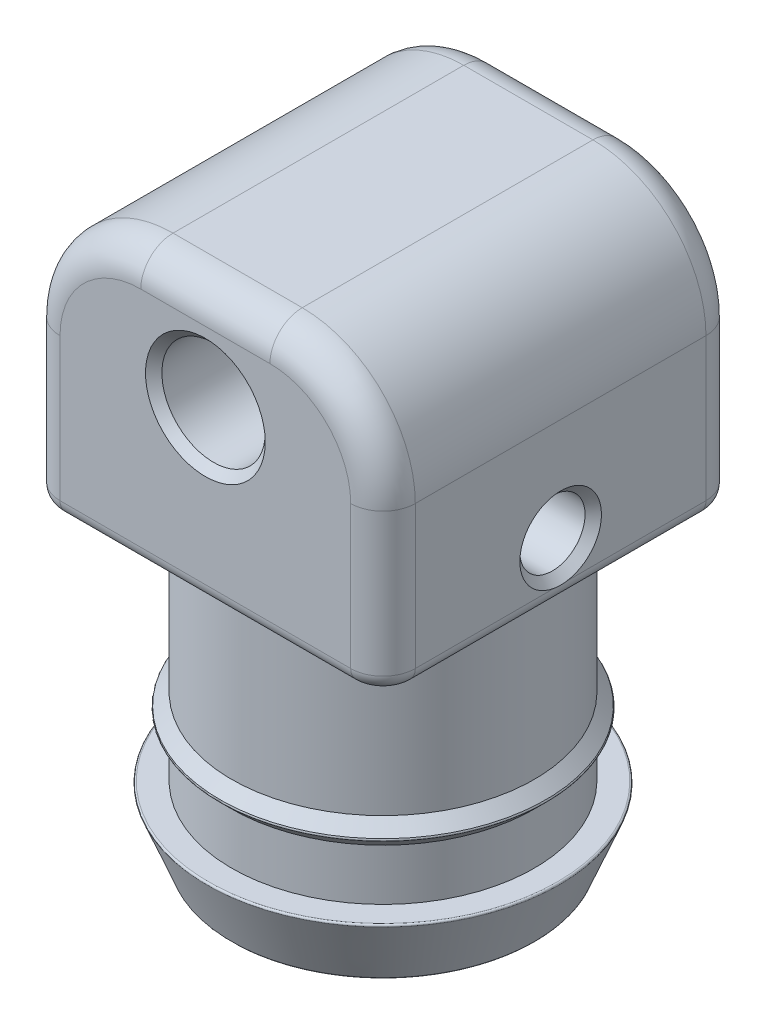
from build123d import *

# Parameters (mm, degrees)
SKETCH1_R                   = 3.2
BOSS_EXTRUDE1_DEPTH         = 11
SKETCH3_R                   = 2.38125
CUT_EXTRUDE1_DEPTH          = 25
F_10_32_TAPPED_HOLE1_REACH  = 40.409
F_10_32_TAPPED_HOLE1_BORE_R = 2.0193
FILLET3_R                   = 0.09921875
CHAMFER1_SIZE               = 0.508
FILLET4_R                   = 7
FILLET5_R                   = 2
FILLET6_R                   = 1


with BuildPart() as part:
    # Sketch1 → Boss-Extrude1 (new, symmetric)
    # profile 1 of 3: a face of its own
    with BuildSketch(Plane.XY):
        with BuildLine():
            Line((-11, 6.35), (-11, 0))
            Line((-11, 0), (-6.35, 0))
            ThreePointArc((-6.35, 0), (-4.49012806, 4.490128061), (2e-09, 6.35))
            Line((2e-09, 6.35), (-11, 6.35))
        make_face()
    # profile 2 of 3: a face of its own
    with BuildSketch(Plane.XY):
        with BuildLine():
            Line((-6.35, 0), (-11, 0))
            Line((-11, 0), (-11, -10.5))
            Line((-11, -10.5), (11, -10.5))
            Line((11, -10.5), (11, 0))
            Line((11, 0), (6.35, 0))
            ThreePointArc((6.35, 0), (4.490128061, 4.49012806), (2e-09, 6.35))
            ThreePointArc((2e-09, 6.35), (-4.49012806, 4.490128061), (-6.35, 0))
        make_face()
        Circle(SKETCH1_R, mode=Mode.SUBTRACT)
    # profile 3 of 3: a face of its own
    with BuildSketch(Plane.XY):
        with BuildLine():
            Line((11, 6.35), (2e-09, 6.35))
            ThreePointArc((2e-09, 6.35), (4.490128061, 4.49012806), (6.35, 0))
            Line((6.35, 0), (11, 0))
            Line((11, 0), (11, 6.35))
        make_face()
    extrude(amount=BOSS_EXTRUDE1_DEPTH, both=True)

    # Sketch2 → Revolve1 (revolve)
    with BuildSketch(Plane.XY, mode=Mode.PRIVATE) as revolve1_sk:
        Polygon((0, -10), (9.365, -10), (9.365, -20.76875), (10.15875, -21.5625), (9.365, -22.35625), (9.365, -25.53125), (10.9525, -25.53125), (9.365, -29.5), (0, -29.5), align=None)
    revolve(revolve1_sk.sketch.rotate(Axis((0, 9.54404991, 0), (0, -1, 0)), 180), axis=Axis((0, 9.54404991, 0), (0, -1, 0)))

    # Sketch3 → Cut-Extrude1 (cut)
    with BuildSketch(Plane.XZ.offset(29.5)):
        Circle(SKETCH3_R)
    extrude(amount=-CUT_EXTRUDE1_DEPTH, mode=Mode.SUBTRACT)

    # #10-32 Tapped Hole1 bore → #10-32 Tapped Hole1 (cut, up to next)
    with BuildSketch(Plane(origin=(11, 0, 0), x_dir=(0, 0, -1), z_dir=(1, 0, 0)), mode=Mode.PRIVATE) as f_10_32_tapped_hole1_sk1:
        with Locations((0, -7)):
            Circle(F_10_32_TAPPED_HOLE1_BORE_R)
    f_10_32_tapped_hole1_tool1 = extrude(f_10_32_tapped_hole1_sk1.sketch, amount=-F_10_32_TAPPED_HOLE1_REACH, mode=Mode.PRIVATE) & part.part
    add(f_10_32_tapped_hole1_tool1.solids().sort_by_distance((11, -7, 0))[0], mode=Mode.SUBTRACT)

    # Fillet3
    fillet3_edges = [part.edges().sort_by_distance(p)[0] for p in [
        (10.15875, -21.5625, 0),
        (10.9525, -25.53125, 0),
        (9.365, -29.5, 0),
        (-2.38125, -4.5, 0),
        (-2.38125, -29.5, 0),
        (1.892404965, -8.410112563, -1.445390956),
    ]]
    fillet(fillet3_edges, radius=FILLET3_R)

    # Chamfer1
    chamfer1_edges = [part.edges().sort_by_distance(p)[0] for p in [
        (-3.2, 0, 11),
        (11, -7, 2.0193),
        (-3.2, 0, -11),
    ]]
    chamfer(chamfer1_edges, length=CHAMFER1_SIZE)

    # Fillet4
    fillet4_edges = [part.edges().sort_by_distance(p)[0] for p in [
        (-11, 6.35, 0),
        (11, 6.35, 0),
    ]]
    fillet(fillet4_edges, radius=FILLET4_R)

    # Fillet5
    fillet5_edges = [part.edges().sort_by_distance(p)[0] for p in [
        (0, 6.35, -11),
        (0, 6.35, 11),
        (11, -5.575, -11),
        (-11, -5.575, -11),
        (-8.949747468, 4.299747468, -11),
        (8.949747468, 4.299747468, -11),
        (11, -5.575, 11),
        (-11, -5.575, 11),
        (-8.949747468, 4.299747468, 11),
        (8.949747468, 4.299747468, 11),
    ]]
    fillet(fillet5_edges, radius=FILLET5_R)

    # Fillet6
    fillet6_edges = [part.edges().sort_by_distance(p)[0] for p in [
        (0, -10.5, -11),
        (11, -10.5, 0),
        (0, -10.5, 11),
        (-11, -10.5, 0),
        (-10.414213562, -10.5, 10.414213562),
        (-10.414213562, -10.5, -10.414213562),
        (10.414213562, -10.5, 10.414213562),
        (10.414213562, -10.5, -10.414213562),
    ]]
    fillet(fillet6_edges, radius=FILLET6_R)


solid = part.part
